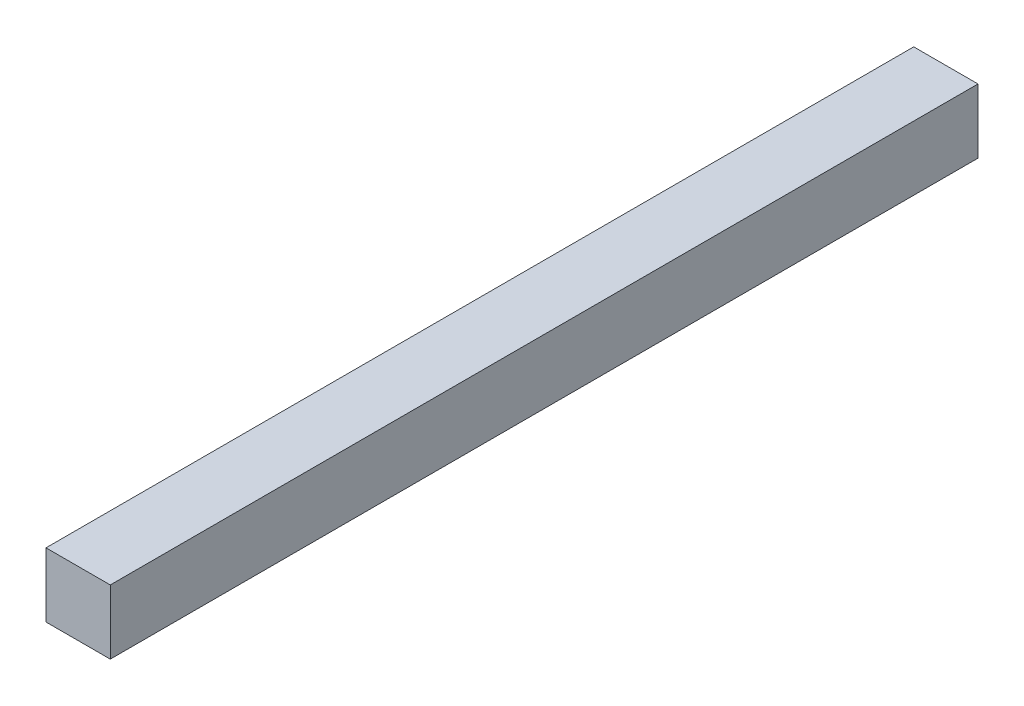
from build123d import *

# Parameters (mm, degrees)
SKETCH1_W           = 20
SKETCH1_H           = 20
BOSS_EXTRUDE1_DEPTH = 270


with BuildPart() as part:
    # Sketch1 → Boss-Extrude1 (new body)
    with BuildSketch(Plane.XY):
        Rectangle(SKETCH1_W, SKETCH1_H)
    extrude(amount=BOSS_EXTRUDE1_DEPTH)


solid = part.part
